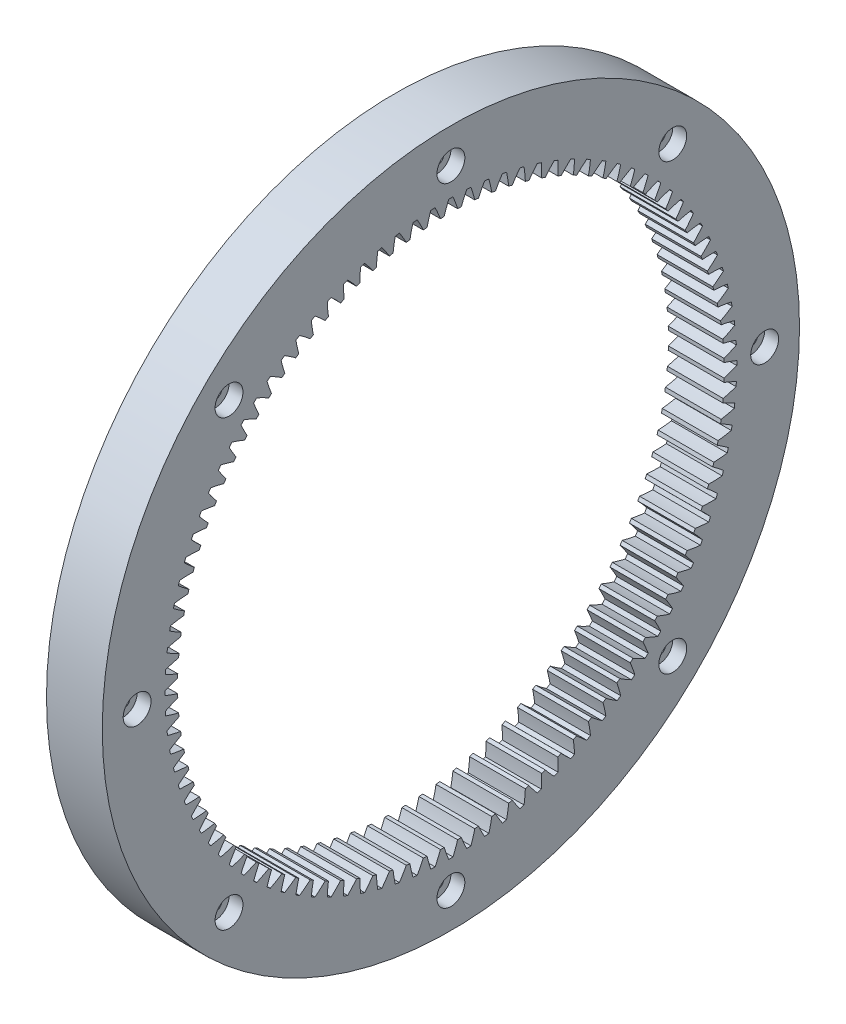
from build123d import *

# Parameters (mm, degrees)
SKETCH1_R           = 125
BOSS_EXTRUDE1_DEPTH = 20
SKETCH2_R           = 2.5
CUT_EXTRUDE1_DEPTH  = 20
SKETCH3_R           = 5
CUT_EXTRUDE2_DEPTH  = 5


with BuildPart() as part:
    # Sketch1 → Boss-Extrude1 (new body)
    with BuildSketch(Plane(origin=(-19.280487823, 0, 0), x_dir=(0, -1, 0), z_dir=(-1, 0, 0))):
        with Locations(Location((2.171605872, 9.010975773, 0), (0, 0, 270))):
            Circle(SKETCH1_R)
        with BuildLine():
            ThreePointArc((-100.17230413, 3.338314463), (-97.987706609, 4.354088508), (-95.756715154, 5.263451126))
            ThreePointArc((-95.756715154, 5.263451126), (-95.780037043, 5.932721383), (-95.798785001, 6.602135382))
            ThreePointArc((-95.798785001, 6.602135382), (-98.082473455, 7.369618468), (-100.326541153, 8.246216102))
            ThreePointArc((-100.326541153, 8.246216102), (-100.329394128, 9.010975773), (-100.326541153, 9.775735444))
            ThreePointArc((-100.326541153, 9.775735444), (-98.082473455, 10.652333077), (-95.798785001, 11.419816164))
            ThreePointArc((-95.798785001, 11.419816164), (-95.780037043, 12.089230162), (-95.756715154, 12.758500419))
            ThreePointArc((-95.756715154, 12.758500419), (-97.987706609, 13.667863038), (-100.17230413, 14.683637083))
            ThreePointArc((-100.17230413, 14.683637083), (-100.127131818, 15.447066815), (-100.076264816, 16.210138268))
            ThreePointArc((-100.076264816, 16.210138268), (-97.781583253, 16.94409996), (-95.454210475, 17.566674609))
            ThreePointArc((-95.454210475, 17.566674609), (-95.393466659, 18.233590478), (-95.328166962, 18.900075689))
            ThreePointArc((-95.328166962, 18.900075689), (-97.497656714, 19.947729001), (-99.614162451, 21.098670661))
            ThreePointArc((-99.614162451, 21.098670661), (-99.521143127, 21.857757546), (-99.422462847, 22.616129286))
            ThreePointArc((-99.422462847, 22.616129286), (-97.086223477, 23.204558425), (-94.724351452, 23.67976762))
            ThreePointArc((-94.724351452, 23.67976762), (-94.621851506, 24.341553347), (-94.514831711, 25.0026232))
            ThreePointArc((-94.514831711, 25.0026232), (-96.614257774, 26.184432596), (-98.654318846, 27.465999631))
            ThreePointArc((-98.654318846, 27.465999631), (-98.513819615, 28.217747899), (-98.367715502, 28.96842698))
            ThreePointArc((-98.367715502, 28.96842698), (-95.999138395, 29.409001304), (-93.612088353, 29.73496961))
            ThreePointArc((-93.612088353, 29.73496961), (-93.468236798, 30.38901343), (-93.319919262, 31.042058984))
            ThreePointArc((-93.319919262, 31.042058984), (-95.340996162, 32.353360402), (-97.29656138, 33.760495052))
            ThreePointArc((-97.29656138, 33.760495052), (-97.109136726, 34.501937897), (-96.916185387, 35.241961731))
            ThreePointArc((-96.916185387, 35.241961731), (-94.524618236, 35.532942495), (-92.121810772, 35.708383465))
            ThreePointArc((-92.121810772, 35.708383465), (-91.937175324, 36.352104165), (-91.74814539, 36.994548148))
            ThreePointArc((-91.74814539, 36.994548148), (-93.682896858, 38.430166481), (-95.546248499, 39.957315427))
            ThreePointArc((-95.546248499, 39.957315427), (-95.312638104, 40.685526713), (-95.073601029, 41.411974764))
            ThreePointArc((-95.073601029, 41.411974764), (-92.668482257, 41.552213601), (-90.259400155, 41.576434849))
            ThreePointArc((-90.259400155, 41.576434849), (-90.034709485, 42.207291957), (-89.805713167, 42.836598936))
            ThreePointArc((-89.805713167, 42.836598936), (-91.646503624, 44.390868454), (-93.410287891, 46.032004738))
            ThreePointArc((-93.410287891, 46.032004738), (-93.131413708, 46.744110548), (-92.847234267, 47.454115857))
            ThreePointArc((-92.847234267, 47.454115857), (-90.438055777, 47.443059307), (-88.032206584, 47.315965243))
            ThreePointArc((-88.032206584, 47.315965243), (-87.768347445, 47.931469055), (-87.500288486, 48.545155443))
            ThreePointArc((-87.500288486, 48.545155443), (-89.239853174, 50.211942154), (-90.897109215, 51.960588961))
            ThreePointArc((-90.897109215, 51.960588961), (-90.574071832, 52.653778938), (-90.245871553, 53.344539439))
            ThreePointArc((-90.245871553, 53.344539439), (-87.842141273, 53.182231137), (-85.449019776, 52.904323344))
            ThreePointArc((-85.449019776, 52.904323344), (-85.147033498, 53.502044747), (-84.840969806, 54.097688604))
            ThreePointArc((-84.840969806, 54.097688604), (-86.472443456, 55.870414462), (-88.016630839, 57.719670683))
            ThreePointArc((-88.016630839, 57.719670683), (-87.650705139, 58.391209122), (-87.279779277, 59.059998699))
            ThreePointArc((-87.279779277, 59.059998699), (-84.890983632, 58.747079203), (-82.520034388, 58.319454455))
            ThreePointArc((-82.520034388, 58.319454455), (-82.181112774, 58.897034516), (-81.838252241, 59.472285107))
            ThreePointArc((-81.838252241, 59.472285107), (-83.355196173, 61.343953975), (-84.780220697, 63.286521438))
            ThreePointArc((-84.780220697, 63.286521438), (-84.37285082, 63.933758085), (-83.96066325, 64.577937331))
            ThreePointArc((-83.96066325, 64.577937331), (-81.596229726, 64.11564159), (-79.256809788, 63.539987528))
            ThreePointArc((-79.256809788, 63.539987528), (-78.882290407, 64.095146802), (-78.503986147, 64.647733877))
            ThreePointArc((-78.503986147, 64.647733877), (-79.900413677, 66.610959131), (-81.200651419, 68.639171411))
            ThreePointArc((-81.200651419, 68.639171411), (-80.753445068, 69.259551918), (-80.301622507, 69.876578552))
            ThreePointArc((-80.301622507, 69.876578552), (-77.970882442, 69.266731037), (-75.672224433, 68.545319503))
            ThreePointArc((-75.672224433, 68.545319503), (-75.26358534, 69.075867031), (-74.851330349, 69.60360978))
            ThreePointArc((-74.851330349, 69.60360978), (-76.121730414, 71.650643467), (-77.292049931, 73.756496138))
            ThreePointArc((-77.292049931, 73.756496138), (-76.806772025, 74.347572146), (-76.31709761, 74.935011046))
            ThreePointArc((-76.31709761, 74.935011046), (-74.02924937, 74.180018546), (-71.780425043, 73.315696622))
            ThreePointArc((-71.780425043, 73.315696622), (-71.339278951, 73.819538575), (-70.894700209, 74.320354239))
            ThreePointArc((-70.894700209, 74.320354239), (-72.034059121, 76.443117653), (-73.069841697, 78.618299875))
            ThreePointArc((-73.069841697, 78.618299875), (-72.548407407, 79.177738678), (-72.022813659, 79.73327149))
            ThreePointArc((-72.022813659, 79.73327149), (-69.786886336, 78.836113616), (-67.596770773, 77.832292386))
            ThreePointArc((-67.596770773, 77.832292386), (-67.124858684, 78.307440329), (-66.649710741, 78.779352418))
            ThreePointArc((-66.649710741, 78.779352418), (-67.65353197, 80.969467981), (-68.550689844, 83.205395304))
            ThreePointArc((-68.550689844, 83.205395304), (-67.995157032, 83.730989052), (-67.435718229, 84.252423343))
            ThreePointArc((-67.435718229, 84.252423343), (-65.260536008, 83.216640766), (-63.137772593, 82.077281854))
            ThreePointArc((-63.137772593, 82.077281854), (-62.636956929, 82.521860597), (-62.133114977, 82.963006688))
            ThreePointArc((-62.133114977, 82.963006688), (-62.997436901, 85.211831016), (-63.7524294, 87.499679255))
            ThreePointArc((-63.7524294, 87.499679255), (-63.164990501, 87.989353671), (-62.573914493, 88.474631576))
            ThreePointArc((-62.573914493, 88.474631576), (-60.468061822, 87.304312059), (-58.421028135, 86.033911994))
            ThreePointArc((-58.421028135, 86.033911994), (-57.893285386, 86.446166986), (-57.362737858, 86.854806078))
            ThreePointArc((-57.362737858, 86.854806078), (-58.084149392, 89.153464087), (-58.693996907, 91.484204152))
            ThreePointArc((-58.693996907, 91.484204152), (-58.076970273, 91.936026713), (-57.456589766, 92.383233064))
            ThreePointArc((-57.456589766, 92.383233064), (-55.428377485, 91.082995322), (-53.465152231, 89.686567792))
            ThreePointArc((-53.465152231, 89.686567792), (-52.912565157, 90.064872052), (-52.357405883, 90.439391434))
            ThreePointArc((-52.357405883, 90.439391434), (-52.933059945, 92.778811371), (-53.395355686, 95.143244895))
            ThreePointArc((-53.395355686, 95.143244895), (-52.75117644, 95.555432465), (-52.103939793, 95.962802342))
            ThreePointArc((-52.103939793, 95.962802342), (-50.161372329, 94.537777819), (-48.289703462, 93.020833886))
            ThreePointArc((-48.289703462, 93.020833886), (-47.714452871, 93.363694419), (-47.13687281, 93.702616033))
            ThreePointArc((-47.13687281, 93.702616033), (-47.564497558, 96.073565277), (-47.877417054, 98.462360922))
            ThreePointArc((-47.877417054, 98.462360922), (-47.208627477, 98.833286784), (-46.537089038, 99.199212485))
            ThreePointArc((-46.537089038, 99.199212485), (-44.687832817, 97.655025101), (-42.915106958, 96.023551451))
            ThreePointArc((-42.915106958, 96.023551451), (-42.319463102, 96.329615143), (-41.721741699, 96.631601421))
            ThreePointArc((-41.721741699, 96.631601421), (-41.999649492, 99.024722918), (-42.161957794, 101.428453198))
            ThreePointArc((-42.161957794, 101.428453198), (-41.471197292, 101.756653478), (-40.778007316, 102.07969086))
            ThreePointArc((-40.778007316, 102.07969086), (-39.029360508, 100.422434819), (-37.362573797, 98.682870131))
            ThreePointArc((-37.362573797, 98.682870131), (-36.74888741, 98.95092909), (-36.133383598, 99.214788229))
            ThreePointArc((-36.133383598, 99.214788229), (-36.260477662, 101.620637423), (-36.271534212, 104.029815912))
            ThreePointArc((-36.271534212, 104.029815912), (-35.561528902, 104.313995353), (-34.849423093, 104.592869536))
            ThreePointArc((-34.849423093, 104.592869536), (-33.208286808, 102.82908527), (-31.654017291, 100.988294812))
            ThreePointArc((-31.654017291, 100.988294812), (-31.024710312, 101.21729113), (-30.393853204, 101.4419818))
            ThreePointArc((-30.393853204, 101.4419818), (-30.369631955, 103.851063902), (-30.229393119, 106.256182675))
            ThreePointArc((-30.229393119, 106.256182675), (-29.502945068, 106.49521975), (-28.774733782, 106.728830144))
            ThreePointArc((-28.774733782, 106.728830144), (-27.247584835, 104.865478504), (-25.811966503, 102.930727035))
            ThreePointArc((-25.811966503, 102.930727035), (-25.169522519, 103.119756969), (-24.52580182, 103.304392417))
            ThreePointArc((-24.52580182, 103.304392417), (-24.35036085, 105.707199881), (-24.059380085, 108.098767032))
            ThreePointArc((-24.059380085, 108.098767032), (-23.319356252, 108.291718372), (-22.577913407, 108.479143025))
            ThreePointArc((-22.577913407, 108.479143025), (-21.170778757, 106.523577807), (-19.859477339, 104.502500907))
            ThreePointArc((-19.859477339, 104.502500907), (-19.206431784, 104.650818443), (-18.552387965, 104.794669998))
            ThreePointArc((-18.552387965, 104.794669998), (-18.226419659, 107.181720041), (-17.785845334, 109.550297147))
            ThreePointArc((-17.785845334, 109.550297147), (-17.035166254, 109.69640126), (-16.283417985, 109.836900492))
            ThreePointArc((-16.283417985, 109.836900492), (-15.001850951, 107.796839419), (-13.820041555, 105.697413356))
            ThreePointArc((-13.820041555, 105.697413356), (-13.158971702, 105.804433151), (-12.497185975, 105.906933097))
            ThreePointArc((-12.497185975, 105.906933097), (-12.02197678, 108.268805122), (-11.433547641, 110.605044492))
            ThreePointArc((-11.433547641, 110.605044492), (-10.675175901, 110.703724772), (-9.916089016, 110.796744097))
            ThreePointArc((-9.916089016, 110.796744097), (-8.765147356, 108.680238359), (-7.717494044, 106.510748608))
            ThreePointArc((-7.717494044, 106.510748608), (-7.051008833, 106.576048304), (-6.384092964, 106.63679212))
            ThreePointArc((-6.384092964, 106.63679212), (-5.761518314, 108.964164898), (-5.027556622, 111.258846462))
            ThreePointArc((-5.027556622, 111.258846462), (-4.26448517, 111.309713463), (-3.501055438, 111.354885776))
            ThreePointArc((-3.501055438, 111.354885776), (-2.485281393, 109.170288254), (-1.575918774, 106.939296799))
            ThreePointArc((-1.575918774, 106.939296799), (-0.906648517, 106.962618689), (-0.237234519, 106.981366647))
            ThreePointArc((-0.237234519, 106.981366647), (0.530248568, 109.265055101), (1.406846202, 111.509122798))
            ThreePointArc((1.406846202, 111.509122798), (2.171605872, 111.511975773), (2.936365543, 111.509122798))
            ThreePointArc((2.936365543, 111.509122798), (3.812963177, 109.265055101), (4.580446263, 106.981366647))
            ThreePointArc((4.580446263, 106.981366647), (5.249860262, 106.962618689), (5.919130519, 106.939296799))
            ThreePointArc((5.919130519, 106.939296799), (6.828493138, 109.170288254), (7.844267183, 111.354885776))
            ThreePointArc((7.844267183, 111.354885776), (8.607696915, 111.309713463), (9.370768367, 111.258846462))
            ThreePointArc((9.370768367, 111.258846462), (10.104730059, 108.964164898), (10.727304709, 106.63679212))
            ThreePointArc((10.727304709, 106.63679212), (11.394220578, 106.576048304), (12.060705789, 106.510748608))
            ThreePointArc((12.060705789, 106.510748608), (13.108359101, 108.680238359), (14.259300761, 110.796744097))
            ThreePointArc((14.259300761, 110.796744097), (15.018387646, 110.703724772), (15.776759386, 110.605044492))
            ThreePointArc((15.776759386, 110.605044492), (16.365188524, 108.268805122), (16.840397719, 105.906933097))
            ThreePointArc((16.840397719, 105.906933097), (17.502183446, 105.804433151), (18.1632533, 105.697413356))
            ThreePointArc((18.1632533, 105.697413356), (19.345062695, 107.796839419), (20.62662973, 109.836900492))
            ThreePointArc((20.62662973, 109.836900492), (21.378377999, 109.69640126), (22.129057079, 109.550297147))
            ThreePointArc((22.129057079, 109.550297147), (22.569631403, 107.181720041), (22.89559971, 104.794669998))
            ThreePointArc((22.89559971, 104.794669998), (23.549643529, 104.650818443), (24.202689084, 104.502500907))
            ThreePointArc((24.202689084, 104.502500907), (25.513990502, 106.523577807), (26.921125151, 108.479143025))
            ThreePointArc((26.921125151, 108.479143025), (27.662567997, 108.291718372), (28.40259183, 108.098767032))
            ThreePointArc((28.40259183, 108.098767032), (28.693572595, 105.707199881), (28.869013565, 103.304392417))
            ThreePointArc((28.869013565, 103.304392417), (29.512734264, 103.119756969), (30.155178247, 102.930727035))
            ThreePointArc((30.155178247, 102.930727035), (31.59079658, 104.865478504), (33.117945527, 106.728830144))
            ThreePointArc((33.117945527, 106.728830144), (33.846156813, 106.49521975), (34.572604864, 106.256182675))
            ThreePointArc((34.572604864, 106.256182675), (34.7128437, 103.851063902), (34.737064949, 101.4419818))
            ThreePointArc((34.737064949, 101.4419818), (35.367922056, 101.21729113), (35.997229035, 100.988294812))
            ThreePointArc((35.997229035, 100.988294812), (37.551498553, 102.82908527), (39.192634838, 104.592869536))
            ThreePointArc((39.192634838, 104.592869536), (39.904740647, 104.313995353), (40.614745956, 104.029815912))
            ThreePointArc((40.614745956, 104.029815912), (40.603689406, 101.620637423), (40.476595343, 99.214788229))
            ThreePointArc((40.476595343, 99.214788229), (41.092099155, 98.95092909), (41.705785542, 98.682870131))
            ThreePointArc((41.705785542, 98.682870131), (43.372572253, 100.422434819), (45.121219061, 102.07969086))
            ThreePointArc((45.121219061, 102.07969086), (45.814409037, 101.756653478), (46.505169538, 101.428453198))
            ThreePointArc((46.505169538, 101.428453198), (46.342861237, 99.024722918), (46.064953444, 96.631601421))
            ThreePointArc((46.064953444, 96.631601421), (46.662674847, 96.329615143), (47.258318703, 96.023551451))
            ThreePointArc((47.258318703, 96.023551451), (49.031044562, 97.655025101), (50.880300782, 99.199212485))
            ThreePointArc((50.880300782, 99.199212485), (51.551839221, 98.833286784), (52.220628799, 98.462360922))
            ThreePointArc((52.220628799, 98.462360922), (51.907709302, 96.073565277), (51.480084555, 93.702616033))
            ThreePointArc((51.480084555, 93.702616033), (52.057664616, 93.363694419), (52.632915207, 93.020833886))
            ThreePointArc((52.632915207, 93.020833886), (54.504584074, 94.537777819), (56.447151538, 95.962802342))
            ThreePointArc((56.447151538, 95.962802342), (57.094388185, 95.555432465), (57.738567431, 95.143244895))
            ThreePointArc((57.738567431, 95.143244895), (57.27627169, 92.778811371), (56.700617627, 90.439391434))
            ThreePointArc((56.700617627, 90.439391434), (57.255776902, 90.064872052), (57.808363976, 89.686567792))
            ThreePointArc((57.808363976, 89.686567792), (59.77158923, 91.082995322), (61.799801511, 92.383233064))
            ThreePointArc((61.799801511, 92.383233064), (62.420182018, 91.936026713), (63.037208652, 91.484204152))
            ThreePointArc((63.037208652, 91.484204152), (62.427361137, 89.153464087), (61.705949602, 86.854806078))
            ThreePointArc((61.705949602, 86.854806078), (62.23649713, 86.446166986), (62.764239879, 86.033911994))
            ThreePointArc((62.764239879, 86.033911994), (64.811273567, 87.304312059), (66.917126237, 88.474631576))
            ThreePointArc((66.917126237, 88.474631576), (67.508202246, 87.989353671), (68.095641145, 87.499679255))
            ThreePointArc((68.095641145, 87.499679255), (67.340648645, 85.211831016), (66.476326721, 82.963006688))
            ThreePointArc((66.476326721, 82.963006688), (66.980168674, 82.521860597), (67.480984338, 82.077281854))
            ThreePointArc((67.480984338, 82.077281854), (69.603747752, 83.216640766), (71.778929974, 84.252423343))
            ThreePointArc((71.778929974, 84.252423343), (72.338368777, 83.730989052), (72.893901589, 83.205395304))
            ThreePointArc((72.893901589, 83.205395304), (71.996743715, 80.969467981), (70.992922485, 78.779352418))
            ThreePointArc((70.992922485, 78.779352418), (71.468070429, 78.307440329), (71.939982517, 77.832292386))
            ThreePointArc((71.939982517, 77.832292386), (74.130098081, 78.836113616), (76.366025403, 79.73327149))
            ThreePointArc((76.366025403, 79.73327149), (76.891619152, 79.177738678), (77.413053442, 78.618299875))
            ThreePointArc((77.413053442, 78.618299875), (76.377270866, 76.443117653), (75.237911954, 74.320354239))
            ThreePointArc((75.237911954, 74.320354239), (75.682490696, 73.819538575), (76.123636788, 73.315696622))
            ThreePointArc((76.123636788, 73.315696622), (78.372461115, 74.180018546), (80.660309355, 74.935011046))
            ThreePointArc((80.660309355, 74.935011046), (81.14998377, 74.347572146), (81.635261676, 73.756496138))
            ThreePointArc((81.635261676, 73.756496138), (80.464942158, 71.650643467), (79.194542093, 69.60360978))
            ThreePointArc((79.194542093, 69.60360978), (79.606797085, 69.075867031), (80.015436178, 68.545319503))
            ThreePointArc((80.015436178, 68.545319503), (82.314094187, 69.266731037), (84.644834252, 69.876578552))
            ThreePointArc((84.644834252, 69.876578552), (85.096656813, 69.259551918), (85.543863164, 68.639171411))
            ThreePointArc((85.543863164, 68.639171411), (84.243625421, 66.610959131), (82.847197892, 64.647733877))
            ThreePointArc((82.847197892, 64.647733877), (83.225502151, 64.095146802), (83.600021533, 63.539987528))
            ThreePointArc((83.600021533, 63.539987528), (85.93944147, 64.11564159), (88.303874995, 64.577937331))
            ThreePointArc((88.303874995, 64.577937331), (88.716062564, 63.933758085), (89.123432442, 63.286521438))
            ThreePointArc((89.123432442, 63.286521438), (87.698407918, 61.343953975), (86.181463986, 59.472285107))
            ThreePointArc((86.181463986, 59.472285107), (86.524324519, 58.897034516), (86.863246133, 58.319454455))
            ThreePointArc((86.863246133, 58.319454455), (89.234195377, 58.747079203), (91.622991022, 59.059998699))
            ThreePointArc((91.622991022, 59.059998699), (91.993916884, 58.391209122), (92.359842584, 57.719670683))
            ThreePointArc((92.359842584, 57.719670683), (90.815655201, 55.870414462), (89.18418155, 54.097688604))
            ThreePointArc((89.18418155, 54.097688604), (89.490245243, 53.502044747), (89.79223152, 52.904323344))
            ThreePointArc((89.79223152, 52.904323344), (92.185353018, 53.182231137), (94.589083298, 53.344539439))
            ThreePointArc((94.589083298, 53.344539439), (94.917283577, 52.653778938), (95.240320959, 51.960588961))
            ThreePointArc((95.240320959, 51.960588961), (93.583064919, 50.211942154), (91.843500231, 48.545155443))
            ThreePointArc((91.843500231, 48.545155443), (92.111559189, 47.931469055), (92.375418329, 47.315965243))
            ThreePointArc((92.375418329, 47.315965243), (94.781267522, 47.443059307), (97.190446012, 47.454115857))
            ThreePointArc((97.190446012, 47.454115857), (97.474625452, 46.744110548), (97.753499635, 46.032004738))
            ThreePointArc((97.753499635, 46.032004738), (95.989715369, 44.390868454), (94.148924912, 42.836598936))
            ThreePointArc((94.148924912, 42.836598936), (94.37792123, 42.207291957), (94.602611899, 41.576434849))
            ThreePointArc((94.602611899, 41.576434849), (97.011694001, 41.552213601), (99.416812774, 41.411974764))
            ThreePointArc((99.416812774, 41.411974764), (99.655849849, 40.685526713), (99.889460244, 39.957315427))
            ThreePointArc((99.889460244, 39.957315427), (98.026108603, 38.430166481), (96.091357134, 36.994548148))
            ThreePointArc((96.091357134, 36.994548148), (96.280387069, 36.352104165), (96.465022517, 35.708383465))
            ThreePointArc((96.465022517, 35.708383465), (98.867829981, 35.532942495), (101.259397132, 35.241961731))
            ThreePointArc((101.259397132, 35.241961731), (101.452348471, 34.501937897), (101.639773124, 33.760495052))
            ThreePointArc((101.639773124, 33.760495052), (99.684207907, 32.353360402), (97.663131007, 31.042058984))
            ThreePointArc((97.663131007, 31.042058984), (97.811448542, 30.38901343), (97.955300098, 29.73496961))
            ThreePointArc((97.955300098, 29.73496961), (100.34235014, 29.409001304), (102.710927246, 28.96842698))
            ThreePointArc((102.710927246, 28.96842698), (102.857031359, 28.217747899), (102.997530591, 27.465999631))
            ThreePointArc((102.997530591, 27.465999631), (100.957469519, 26.184432596), (98.858043456, 25.0026232))
            ThreePointArc((98.858043456, 25.0026232), (98.965063251, 24.341553347), (99.067563196, 23.67976762))
            ThreePointArc((99.067563196, 23.67976762), (101.429435222, 23.204558425), (103.765674591, 22.616129286))
            ThreePointArc((103.765674591, 22.616129286), (103.864354872, 21.857757546), (103.957374196, 21.098670661))
            ThreePointArc((103.957374196, 21.098670661), (101.840868459, 19.947729001), (99.671378707, 18.900075689))
            ThreePointArc((99.671378707, 18.900075689), (99.736678403, 18.233590478), (99.797422219, 17.566674609))
            ThreePointArc((99.797422219, 17.566674609), (102.124794998, 16.94409996), (104.419476561, 16.210138268))
            ThreePointArc((104.419476561, 16.210138268), (104.470343563, 15.447066815), (104.515515875, 14.683637083))
            ThreePointArc((104.515515875, 14.683637083), (102.330918353, 13.667863038), (100.099926899, 12.758500419))
            ThreePointArc((100.099926899, 12.758500419), (100.123248788, 12.089230162), (100.141996746, 11.419816164))
            ThreePointArc((100.141996746, 11.419816164), (102.4256852, 10.652333077), (104.669752898, 9.775735444))
            ThreePointArc((104.669752898, 9.775735444), (104.672605872, 9.010975773), (104.669752898, 8.246216102))
            ThreePointArc((104.669752898, 8.246216102), (102.4256852, 7.369618468), (100.141996746, 6.602135382))
            ThreePointArc((100.141996746, 6.602135382), (100.123248788, 5.932721383), (100.099926899, 5.263451126))
            ThreePointArc((100.099926899, 5.263451126), (102.330918353, 4.354088508), (104.515515875, 3.338314463))
            ThreePointArc((104.515515875, 3.338314463), (104.470343563, 2.574884731), (104.419476561, 1.811813278))
            ThreePointArc((104.419476561, 1.811813278), (102.124794998, 1.077851586), (99.797422219, 0.455276937))
            ThreePointArc((99.797422219, 0.455276937), (99.736678403, -0.211638932), (99.671378707, -0.878124144))
            ThreePointArc((99.671378707, -0.878124144), (101.840868459, -1.925777455), (103.957374196, -3.076719116))
            ThreePointArc((103.957374196, -3.076719116), (103.864354872, -3.835806001), (103.765674591, -4.594177741))
            ThreePointArc((103.765674591, -4.594177741), (101.429435222, -5.182606879), (99.067563196, -5.657816074))
            ThreePointArc((99.067563196, -5.657816074), (98.965063251, -6.319601801), (98.858043456, -6.980671654))
            ThreePointArc((98.858043456, -6.980671654), (100.957469519, -8.16248105), (102.997530591, -9.444048085))
            ThreePointArc((102.997530591, -9.444048085), (102.857031359, -10.195796354), (102.710927246, -10.946475434))
            ThreePointArc((102.710927246, -10.946475434), (100.34235014, -11.387049758), (97.955300098, -11.713018065))
            ThreePointArc((97.955300098, -11.713018065), (97.811448542, -12.367061884), (97.663131007, -13.020107438))
            ThreePointArc((97.663131007, -13.020107438), (99.684207907, -14.331408857), (101.639773124, -15.738543506))
            ThreePointArc((101.639773124, -15.738543506), (101.452348471, -16.479986351), (101.259397132, -17.220010185))
            ThreePointArc((101.259397132, -17.220010185), (98.867829981, -17.51099095), (96.465022517, -17.68643192))
            ThreePointArc((96.465022517, -17.68643192), (96.280387069, -18.330152619), (96.091357134, -18.972596602))
            ThreePointArc((96.091357134, -18.972596602), (98.026108603, -20.408214935), (99.889460244, -21.935363882))
            ThreePointArc((99.889460244, -21.935363882), (99.655849849, -22.663575168), (99.416812774, -23.390023218))
            ThreePointArc((99.416812774, -23.390023218), (97.011694001, -23.530262055), (94.602611899, -23.554483303))
            ThreePointArc((94.602611899, -23.554483303), (94.37792123, -24.185340411), (94.148924912, -24.81464739))
            ThreePointArc((94.148924912, -24.81464739), (95.989715369, -26.368916908), (97.753499635, -28.010053193))
            ThreePointArc((97.753499635, -28.010053193), (97.474625452, -28.722159002), (97.190446012, -29.432164311))
            ThreePointArc((97.190446012, -29.432164311), (94.781267522, -29.421107761), (92.375418329, -29.294013698))
            ThreePointArc((92.375418329, -29.294013698), (92.111559189, -29.909517509), (91.843500231, -30.523203897))
            ThreePointArc((91.843500231, -30.523203897), (93.583064919, -32.189990608), (95.240320959, -33.938637416))
            ThreePointArc((95.240320959, -33.938637416), (94.917283577, -34.631827392), (94.589083298, -35.322587893))
            ThreePointArc((94.589083298, -35.322587893), (92.185353018, -35.160279592), (89.79223152, -34.882371799))
            ThreePointArc((89.79223152, -34.882371799), (89.490245243, -35.480093202), (89.18418155, -36.075737058))
            ThreePointArc((89.18418155, -36.075737058), (90.815655201, -37.848462917), (92.359842584, -39.697719137))
            ThreePointArc((92.359842584, -39.697719137), (91.993916884, -40.369257576), (91.622991022, -41.038047153))
            ThreePointArc((91.622991022, -41.038047153), (89.234195377, -40.725127657), (86.863246133, -40.29750291))
            ThreePointArc((86.863246133, -40.29750291), (86.524324519, -40.875082971), (86.181463986, -41.450333562))
            ThreePointArc((86.181463986, -41.450333562), (87.698407918, -43.322002429), (89.123432442, -45.264569893))
            ThreePointArc((89.123432442, -45.264569893), (88.716062564, -45.911806539), (88.303874995, -46.555985785))
            ThreePointArc((88.303874995, -46.555985785), (85.93944147, -46.093690045), (83.600021533, -45.518035982))
            ThreePointArc((83.600021533, -45.518035982), (83.225502151, -46.073195257), (82.847197892, -46.625782331))
            ThreePointArc((82.847197892, -46.625782331), (84.243625421, -48.589007585), (85.543863164, -50.617219866))
            ThreePointArc((85.543863164, -50.617219866), (85.096656813, -51.237600372), (84.644834252, -51.854627006))
            ThreePointArc((84.644834252, -51.854627006), (82.314094187, -51.244779491), (80.015436178, -50.523367957))
            ThreePointArc((80.015436178, -50.523367957), (79.606797085, -51.053915485), (79.194542093, -51.581658234))
            ThreePointArc((79.194542093, -51.581658234), (80.464942158, -53.628691922), (81.635261676, -55.734544592))
            ThreePointArc((81.635261676, -55.734544592), (81.14998377, -56.3256206), (80.660309355, -56.9130595))
            ThreePointArc((80.660309355, -56.9130595), (78.372461115, -56.158067), (76.123636788, -55.293745076))
            ThreePointArc((76.123636788, -55.293745076), (75.682490696, -55.797587029), (75.237911954, -56.298402693))
            ThreePointArc((75.237911954, -56.298402693), (76.377270866, -58.421166107), (77.413053442, -60.596348329))
            ThreePointArc((77.413053442, -60.596348329), (76.891619152, -61.155787132), (76.366025403, -61.711319944))
            ThreePointArc((76.366025403, -61.711319944), (74.130098081, -60.81416207), (71.939982517, -59.81034084))
            ThreePointArc((71.939982517, -59.81034084), (71.468070429, -60.285488783), (70.992922485, -60.757400872))
            ThreePointArc((70.992922485, -60.757400872), (71.996743715, -62.947516436), (72.893901589, -65.183443758))
            ThreePointArc((72.893901589, -65.183443758), (72.338368777, -65.709037507), (71.778929974, -66.230471797))
            ThreePointArc((71.778929974, -66.230471797), (69.603747752, -65.194689221), (67.480984338, -64.055330309))
            ThreePointArc((67.480984338, -64.055330309), (66.980168674, -64.499909051), (66.476326721, -64.941055143))
            ThreePointArc((66.476326721, -64.941055143), (67.340648645, -67.18987947), (68.095641145, -69.47772771))
            ThreePointArc((68.095641145, -69.47772771), (67.508202246, -69.967402125), (66.917126237, -70.452680031))
            ThreePointArc((66.917126237, -70.452680031), (64.811273567, -69.282360513), (62.764239879, -68.011960448))
            ThreePointArc((62.764239879, -68.011960448), (62.23649713, -68.42421544), (61.705949602, -68.832854533))
            ThreePointArc((61.705949602, -68.832854533), (62.427361137, -71.131512541), (63.037208652, -73.462252607))
            ThreePointArc((63.037208652, -73.462252607), (62.420182018, -73.914075168), (61.799801511, -74.361281519))
            ThreePointArc((61.799801511, -74.361281519), (59.77158923, -73.061043776), (57.808363976, -71.664616247))
            ThreePointArc((57.808363976, -71.664616247), (57.255776902, -72.042920506), (56.700617627, -72.417439888))
            ThreePointArc((56.700617627, -72.417439888), (57.27627169, -74.756859825), (57.738567431, -77.12129335))
            ThreePointArc((57.738567431, -77.12129335), (57.094388185, -77.533480919), (56.447151538, -77.940850796))
            ThreePointArc((56.447151538, -77.940850796), (54.504584074, -76.515826273), (52.632915207, -74.998882341))
            ThreePointArc((52.632915207, -74.998882341), (52.057664616, -75.341742874), (51.480084555, -75.680664488))
            ThreePointArc((51.480084555, -75.680664488), (51.907709302, -78.051613732), (52.220628799, -80.440409376))
            ThreePointArc((52.220628799, -80.440409376), (51.551839221, -80.811335238), (50.880300782, -81.177260939))
            ThreePointArc((50.880300782, -81.177260939), (49.031044562, -79.633073556), (47.258318703, -78.001599905))
            ThreePointArc((47.258318703, -78.001599905), (46.662674847, -78.307663598), (46.064953444, -78.609649875))
            ThreePointArc((46.064953444, -78.609649875), (46.342861237, -81.002771373), (46.505169538, -83.406501653))
            ThreePointArc((46.505169538, -83.406501653), (45.814409037, -83.734701932), (45.121219061, -84.057739314))
            ThreePointArc((45.121219061, -84.057739314), (43.372572253, -82.400483273), (41.705785542, -80.660918586))
            ThreePointArc((41.705785542, -80.660918586), (41.092099155, -80.928977544), (40.476595343, -81.192836684))
            ThreePointArc((40.476595343, -81.192836684), (40.603689406, -83.598685877), (40.614745956, -86.007864367))
            ThreePointArc((40.614745956, -86.007864367), (39.904740647, -86.292043807), (39.192634838, -86.57091799))
            ThreePointArc((39.192634838, -86.57091799), (37.551498553, -84.807133724), (35.997229035, -82.966343266))
            ThreePointArc((35.997229035, -82.966343266), (35.367922056, -83.195339585), (34.737064949, -83.420030254))
            ThreePointArc((34.737064949, -83.420030254), (34.7128437, -85.829112356), (34.572604864, -88.234231129))
            ThreePointArc((34.572604864, -88.234231129), (33.846156813, -88.473268204), (33.117945527, -88.706878599))
            ThreePointArc((33.117945527, -88.706878599), (31.59079658, -86.843526958), (30.155178247, -84.908775489))
            ThreePointArc((30.155178247, -84.908775489), (29.512734264, -85.097805424), (28.869013565, -85.282440872))
            ThreePointArc((28.869013565, -85.282440872), (28.693572595, -87.685248336), (28.40259183, -90.076815487))
            ThreePointArc((28.40259183, -90.076815487), (27.662567997, -90.269766826), (26.921125151, -90.457191479))
            ThreePointArc((26.921125151, -90.457191479), (25.513990502, -88.501626261), (24.202689084, -86.480549362))
            ThreePointArc((24.202689084, -86.480549362), (23.549643529, -86.628866897), (22.89559971, -86.772718452))
            ThreePointArc((22.89559971, -86.772718452), (22.569631403, -89.159768495), (22.129057079, -91.528345601))
            ThreePointArc((22.129057079, -91.528345601), (21.378377999, -91.674449714), (20.62662973, -91.814948946))
            ThreePointArc((20.62662973, -91.814948946), (19.345062695, -89.774887874), (18.1632533, -87.675461811))
            ThreePointArc((18.1632533, -87.675461811), (17.502183446, -87.782481606), (16.840397719, -87.884981551))
            ThreePointArc((16.840397719, -87.884981551), (16.365188524, -90.246853577), (15.776759386, -92.583092946))
            ThreePointArc((15.776759386, -92.583092946), (15.018387646, -92.681773227), (14.259300761, -92.774792551))
            ThreePointArc((14.259300761, -92.774792551), (13.108359101, -90.658286813), (12.060705789, -88.488797062))
            ThreePointArc((12.060705789, -88.488797062), (11.394220578, -88.554096758), (10.727304709, -88.614840574))
            ThreePointArc((10.727304709, -88.614840574), (10.104730059, -90.942213352), (9.370768367, -93.236894916))
            ThreePointArc((9.370768367, -93.236894916), (8.607696915, -93.287761918), (7.844267183, -93.33293423))
            ThreePointArc((7.844267183, -93.33293423), (6.828493138, -91.148336708), (5.919130519, -88.917345253))
            ThreePointArc((5.919130519, -88.917345253), (5.249860262, -88.940667143), (4.580446263, -88.959415101))
            ThreePointArc((4.580446263, -88.959415101), (3.812963177, -91.243103555), (2.936365543, -93.487171253))
            ThreePointArc((2.936365543, -93.487171253), (2.171605872, -93.490024227), (1.406846202, -93.487171253))
            ThreePointArc((1.406846202, -93.487171253), (0.530248568, -91.243103555), (-0.237234519, -88.959415101))
            ThreePointArc((-0.237234519, -88.959415101), (-0.906648517, -88.940667143), (-1.575918774, -88.917345253))
            ThreePointArc((-1.575918774, -88.917345253), (-2.485281393, -91.148336708), (-3.501055438, -93.33293423))
            ThreePointArc((-3.501055438, -93.33293423), (-4.26448517, -93.287761918), (-5.027556622, -93.236894916))
            ThreePointArc((-5.027556622, -93.236894916), (-5.761518314, -90.942213352), (-6.384092964, -88.614840574))
            ThreePointArc((-6.384092964, -88.614840574), (-7.051008833, -88.554096758), (-7.717494044, -88.488797062))
            ThreePointArc((-7.717494044, -88.488797062), (-8.765147356, -90.658286813), (-9.916089016, -92.774792551))
            ThreePointArc((-9.916089016, -92.774792551), (-10.675175901, -92.681773227), (-11.433547641, -92.583092946))
            ThreePointArc((-11.433547641, -92.583092946), (-12.02197678, -90.246853577), (-12.497185975, -87.884981551))
            ThreePointArc((-12.497185975, -87.884981551), (-13.158971702, -87.782481606), (-13.820041555, -87.675461811))
            ThreePointArc((-13.820041555, -87.675461811), (-15.001850951, -89.774887874), (-16.283417985, -91.814948946))
            ThreePointArc((-16.283417985, -91.814948946), (-17.035166254, -91.674449714), (-17.785845334, -91.528345601))
            ThreePointArc((-17.785845334, -91.528345601), (-18.226419659, -89.159768495), (-18.552387965, -86.772718452))
            ThreePointArc((-18.552387965, -86.772718452), (-19.206431784, -86.628866897), (-19.859477339, -86.480549362))
            ThreePointArc((-19.859477339, -86.480549362), (-21.170778757, -88.501626261), (-22.577913407, -90.457191479))
            ThreePointArc((-22.577913407, -90.457191479), (-23.319356252, -90.269766826), (-24.059380085, -90.076815487))
            ThreePointArc((-24.059380085, -90.076815487), (-24.35036085, -87.685248336), (-24.52580182, -85.282440872))
            ThreePointArc((-24.52580182, -85.282440872), (-25.169522519, -85.097805424), (-25.811966503, -84.908775489))
            ThreePointArc((-25.811966503, -84.908775489), (-27.247584835, -86.843526958), (-28.774733782, -88.706878599))
            ThreePointArc((-28.774733782, -88.706878599), (-29.502945068, -88.473268204), (-30.229393119, -88.234231129))
            ThreePointArc((-30.229393119, -88.234231129), (-30.369631955, -85.829112356), (-30.393853204, -83.420030254))
            ThreePointArc((-30.393853204, -83.420030254), (-31.024710312, -83.195339585), (-31.654017291, -82.966343266))
            ThreePointArc((-31.654017291, -82.966343266), (-33.208286808, -84.807133724), (-34.849423093, -86.57091799))
            ThreePointArc((-34.849423093, -86.57091799), (-35.561528902, -86.292043807), (-36.271534212, -86.007864367))
            ThreePointArc((-36.271534212, -86.007864367), (-36.260477662, -83.598685877), (-36.133383598, -81.192836684))
            ThreePointArc((-36.133383598, -81.192836684), (-36.74888741, -80.928977544), (-37.362573797, -80.660918586))
            ThreePointArc((-37.362573797, -80.660918586), (-39.029360508, -82.400483273), (-40.778007316, -84.057739314))
            ThreePointArc((-40.778007316, -84.057739314), (-41.471197292, -83.734701932), (-42.161957794, -83.406501653))
            ThreePointArc((-42.161957794, -83.406501653), (-41.999649492, -81.002771373), (-41.721741699, -78.609649875))
            ThreePointArc((-41.721741699, -78.609649875), (-42.319463102, -78.307663598), (-42.915106958, -78.001599905))
            ThreePointArc((-42.915106958, -78.001599905), (-44.687832817, -79.633073556), (-46.537089038, -81.177260939))
            ThreePointArc((-46.537089038, -81.177260939), (-47.208627477, -80.811335238), (-47.877417054, -80.440409376))
            ThreePointArc((-47.877417054, -80.440409376), (-47.564497558, -78.051613732), (-47.13687281, -75.680664488))
            ThreePointArc((-47.13687281, -75.680664488), (-47.714452871, -75.341742874), (-48.289703462, -74.998882341))
            ThreePointArc((-48.289703462, -74.998882341), (-50.161372329, -76.515826273), (-52.103939793, -77.940850796))
            ThreePointArc((-52.103939793, -77.940850796), (-52.75117644, -77.533480919), (-53.395355686, -77.12129335))
            ThreePointArc((-53.395355686, -77.12129335), (-52.933059945, -74.756859825), (-52.357405883, -72.417439888))
            ThreePointArc((-52.357405883, -72.417439888), (-52.912565157, -72.042920506), (-53.465152231, -71.664616247))
            ThreePointArc((-53.465152231, -71.664616247), (-55.428377485, -73.061043776), (-57.456589766, -74.361281519))
            ThreePointArc((-57.456589766, -74.361281519), (-58.076970273, -73.914075168), (-58.693996907, -73.462252607))
            ThreePointArc((-58.693996907, -73.462252607), (-58.084149392, -71.131512541), (-57.362737858, -68.832854533))
            ThreePointArc((-57.362737858, -68.832854533), (-57.893285386, -68.42421544), (-58.421028135, -68.011960448))
            ThreePointArc((-58.421028135, -68.011960448), (-60.468061822, -69.282360513), (-62.573914493, -70.452680031))
            ThreePointArc((-62.573914493, -70.452680031), (-63.164990501, -69.967402125), (-63.7524294, -69.47772771))
            ThreePointArc((-63.7524294, -69.47772771), (-62.997436901, -67.18987947), (-62.133114977, -64.941055143))
            ThreePointArc((-62.133114977, -64.941055143), (-62.636956929, -64.499909051), (-63.137772593, -64.055330309))
            ThreePointArc((-63.137772593, -64.055330309), (-65.260536008, -65.194689221), (-67.435718229, -66.230471797))
            ThreePointArc((-67.435718229, -66.230471797), (-67.995157032, -65.709037507), (-68.550689844, -65.183443758))
            ThreePointArc((-68.550689844, -65.183443758), (-67.65353197, -62.947516436), (-66.649710741, -60.757400872))
            ThreePointArc((-66.649710741, -60.757400872), (-67.124858684, -60.285488783), (-67.596770773, -59.81034084))
            ThreePointArc((-67.596770773, -59.81034084), (-69.786886336, -60.81416207), (-72.022813659, -61.711319944))
            ThreePointArc((-72.022813659, -61.711319944), (-72.548407407, -61.155787132), (-73.069841697, -60.596348329))
            ThreePointArc((-73.069841697, -60.596348329), (-72.034059121, -58.421166107), (-70.894700209, -56.298402693))
            ThreePointArc((-70.894700209, -56.298402693), (-71.339278951, -55.797587029), (-71.780425043, -55.293745076))
            ThreePointArc((-71.780425043, -55.293745076), (-74.02924937, -56.158067), (-76.31709761, -56.9130595))
            ThreePointArc((-76.31709761, -56.9130595), (-76.806772025, -56.3256206), (-77.292049931, -55.734544592))
            ThreePointArc((-77.292049931, -55.734544592), (-76.121730414, -53.628691922), (-74.851330349, -51.581658234))
            ThreePointArc((-74.851330349, -51.581658234), (-75.26358534, -51.053915485), (-75.672224433, -50.523367957))
            ThreePointArc((-75.672224433, -50.523367957), (-77.970882442, -51.244779491), (-80.301622507, -51.854627006))
            ThreePointArc((-80.301622507, -51.854627006), (-80.753445068, -51.237600372), (-81.200651419, -50.617219866))
            ThreePointArc((-81.200651419, -50.617219866), (-79.900413677, -48.589007585), (-78.503986147, -46.625782331))
            ThreePointArc((-78.503986147, -46.625782331), (-78.882290407, -46.073195257), (-79.256809788, -45.518035982))
            ThreePointArc((-79.256809788, -45.518035982), (-81.596229726, -46.093690045), (-83.96066325, -46.555985785))
            ThreePointArc((-83.96066325, -46.555985785), (-84.37285082, -45.911806539), (-84.780220697, -45.264569893))
            ThreePointArc((-84.780220697, -45.264569893), (-83.355196173, -43.322002429), (-81.838252241, -41.450333562))
            ThreePointArc((-81.838252241, -41.450333562), (-82.181112774, -40.875082971), (-82.520034388, -40.29750291))
            ThreePointArc((-82.520034388, -40.29750291), (-84.890983632, -40.725127657), (-87.279779277, -41.038047153))
            ThreePointArc((-87.279779277, -41.038047153), (-87.650705139, -40.369257576), (-88.016630839, -39.697719137))
            ThreePointArc((-88.016630839, -39.697719137), (-86.472443456, -37.848462917), (-84.840969806, -36.075737058))
            ThreePointArc((-84.840969806, -36.075737058), (-85.147033498, -35.480093202), (-85.449019776, -34.882371799))
            ThreePointArc((-85.449019776, -34.882371799), (-87.842141273, -35.160279592), (-90.245871553, -35.322587893))
            ThreePointArc((-90.245871553, -35.322587893), (-90.574071832, -34.631827392), (-90.897109215, -33.938637416))
            ThreePointArc((-90.897109215, -33.938637416), (-89.239853174, -32.189990608), (-87.500288486, -30.523203897))
            ThreePointArc((-87.500288486, -30.523203897), (-87.768347445, -29.909517509), (-88.032206584, -29.294013698))
            ThreePointArc((-88.032206584, -29.294013698), (-90.438055777, -29.421107761), (-92.847234267, -29.432164311))
            ThreePointArc((-92.847234267, -29.432164311), (-93.131413708, -28.722159002), (-93.410287891, -28.010053193))
            ThreePointArc((-93.410287891, -28.010053193), (-91.646503624, -26.368916908), (-89.805713167, -24.81464739))
            ThreePointArc((-89.805713167, -24.81464739), (-90.034709485, -24.185340411), (-90.259400155, -23.554483303))
            ThreePointArc((-90.259400155, -23.554483303), (-92.668482257, -23.530262055), (-95.073601029, -23.390023218))
            ThreePointArc((-95.073601029, -23.390023218), (-95.312638104, -22.663575168), (-95.546248499, -21.935363882))
            ThreePointArc((-95.546248499, -21.935363882), (-93.682896858, -20.408214935), (-91.74814539, -18.972596602))
            ThreePointArc((-91.74814539, -18.972596602), (-91.937175324, -18.330152619), (-92.121810772, -17.68643192))
            ThreePointArc((-92.121810772, -17.68643192), (-94.524618236, -17.51099095), (-96.916185387, -17.220010185))
            ThreePointArc((-96.916185387, -17.220010185), (-97.109136726, -16.479986351), (-97.29656138, -15.738543506))
            ThreePointArc((-97.29656138, -15.738543506), (-95.340996162, -14.331408857), (-93.319919262, -13.020107438))
            ThreePointArc((-93.319919262, -13.020107438), (-93.468236798, -12.367061884), (-93.612088353, -11.713018065))
            ThreePointArc((-93.612088353, -11.713018065), (-95.999138395, -11.387049758), (-98.367715502, -10.946475434))
            ThreePointArc((-98.367715502, -10.946475434), (-98.513819615, -10.195796354), (-98.654318846, -9.444048085))
            ThreePointArc((-98.654318846, -9.444048085), (-96.614257774, -8.16248105), (-94.514831711, -6.980671654))
            ThreePointArc((-94.514831711, -6.980671654), (-94.621851506, -6.319601801), (-94.724351452, -5.657816074))
            ThreePointArc((-94.724351452, -5.657816074), (-97.086223477, -5.182606879), (-99.422462847, -4.594177741))
            ThreePointArc((-99.422462847, -4.594177741), (-99.521143127, -3.835806001), (-99.614162451, -3.076719116))
            ThreePointArc((-99.614162451, -3.076719116), (-97.497656714, -1.925777455), (-95.328166962, -0.878124144))
            ThreePointArc((-95.328166962, -0.878124144), (-95.393466659, -0.211638932), (-95.454210475, 0.455276937))
            ThreePointArc((-95.454210475, 0.455276937), (-97.781583253, 1.077851586), (-100.076264816, 1.811813278))
            ThreePointArc((-100.076264816, 1.811813278), (-100.127131818, 2.574884731), (-100.17230413, 3.338314463))
        make_face(mode=Mode.SUBTRACT)
    extrude(amount=-BOSS_EXTRUDE1_DEPTH)

    # Sketch2 → Cut-Extrude1 (cut)
    with BuildSketch(Plane.ZY.offset(19.280487823)):
        with Locations((88.560488656, 77.377907011)):
            Circle(SKETCH2_R)
        with Locations((121.510975773, -2.171605872)):
            Circle(SKETCH2_R)
        with Locations((9.010975773, 110.328394128)):
            Circle(SKETCH2_R)
        with Locations((88.560488656, -81.721118756)):
            Circle(SKETCH2_R)
        with Locations((9.010975773, -114.671605872)):
            Circle(SKETCH2_R)
        with Locations((-70.538537111, -81.721118756)):
            Circle(SKETCH2_R)
        with Locations((-103.489024227, -2.171605872)):
            Circle(SKETCH2_R)
        with Locations((-70.538537111, 77.377907011)):
            Circle(SKETCH2_R)
    extrude(amount=-CUT_EXTRUDE1_DEPTH, mode=Mode.SUBTRACT)

    # Sketch3 → Cut-Extrude2 (cut)
    with BuildSketch(Plane(origin=(0.719512177, 0, 0), x_dir=(0, 0, -1), z_dir=(1, 0, 0))):
        with Locations((-9.010975773, 110.328394128)):
            Circle(SKETCH3_R)
        with Locations((70.538537111, 77.377907011)):
            Circle(SKETCH3_R)
        with Locations((103.489024227, -2.171605872)):
            Circle(SKETCH3_R)
        with Locations((70.538537111, -81.721118756)):
            Circle(SKETCH3_R)
        with Locations((-9.010975773, -114.671605872)):
            Circle(SKETCH3_R)
        with Locations((-88.560488656, -81.721118756)):
            Circle(SKETCH3_R)
        with Locations((-121.510975773, -2.171605872)):
            Circle(SKETCH3_R)
        with Locations((-88.560488656, 77.377907011)):
            Circle(SKETCH3_R)
    extrude(amount=-CUT_EXTRUDE2_DEPTH, mode=Mode.SUBTRACT)


solid = part.part
